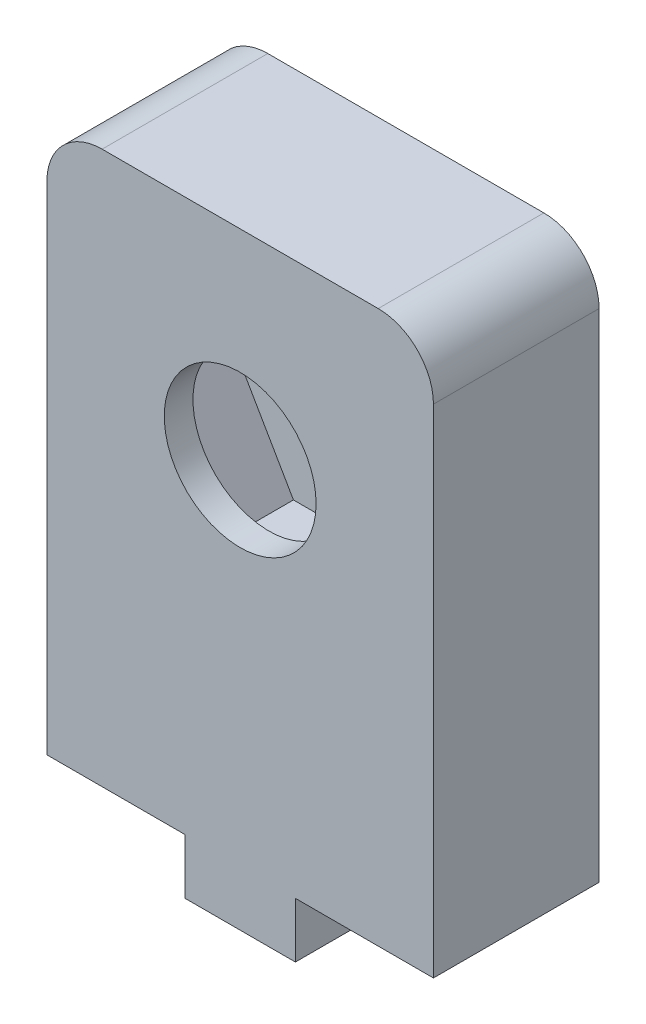
from build123d import *

# Parameters (mm, degrees)
SKETCH1_R           = 1.375
BOSS_EXTRUDE1_DEPTH = 3
CUT_EXTRUDE1_DEPTH  = 0.98


with BuildPart() as part:
    # Sketch1 → Boss-Extrude1 (new body)
    with BuildSketch(Plane.XY):
        with BuildLine():
            Line((-1, -6.375), (-1, -7.375))
            Line((-1, -7.375), (1, -7.375))
            Line((1, -7.375), (1, -6.375))
            Line((1, -6.375), (3.5, -6.375))
            Line((3.5, -6.375), (3.5, 2.625))
            ThreePointArc((3.5, 2.625), (3.207106781, 3.332106781), (2.5, 3.625))
            Line((2.5, 3.625), (-2.5, 3.625))
            ThreePointArc((-2.5, 3.625), (-3.207106781, 3.332106781), (-3.5, 2.625))
            Line((-3.5, 2.625), (-3.5, -6.375))
            Line((-3.5, -6.375), (-1, -6.375))
        make_face()
        Circle(SKETCH1_R, mode=Mode.SUBTRACT)
    extrude(amount=BOSS_EXTRUDE1_DEPTH)

    # Sketch2 → Cut-Extrude1 (cut, symmetric)
    with BuildSketch(Plane.XY.offset(1.5)):
        Polygon((-1.515544457, -2.625), (1.515544457, -2.625), (3.031088913, 0), (1.515544457, 2.625), (-1.515544457, 2.625), (-3.031088913, 0), align=None)
    extrude(amount=CUT_EXTRUDE1_DEPTH, both=True, mode=Mode.SUBTRACT)


solid = part.part
